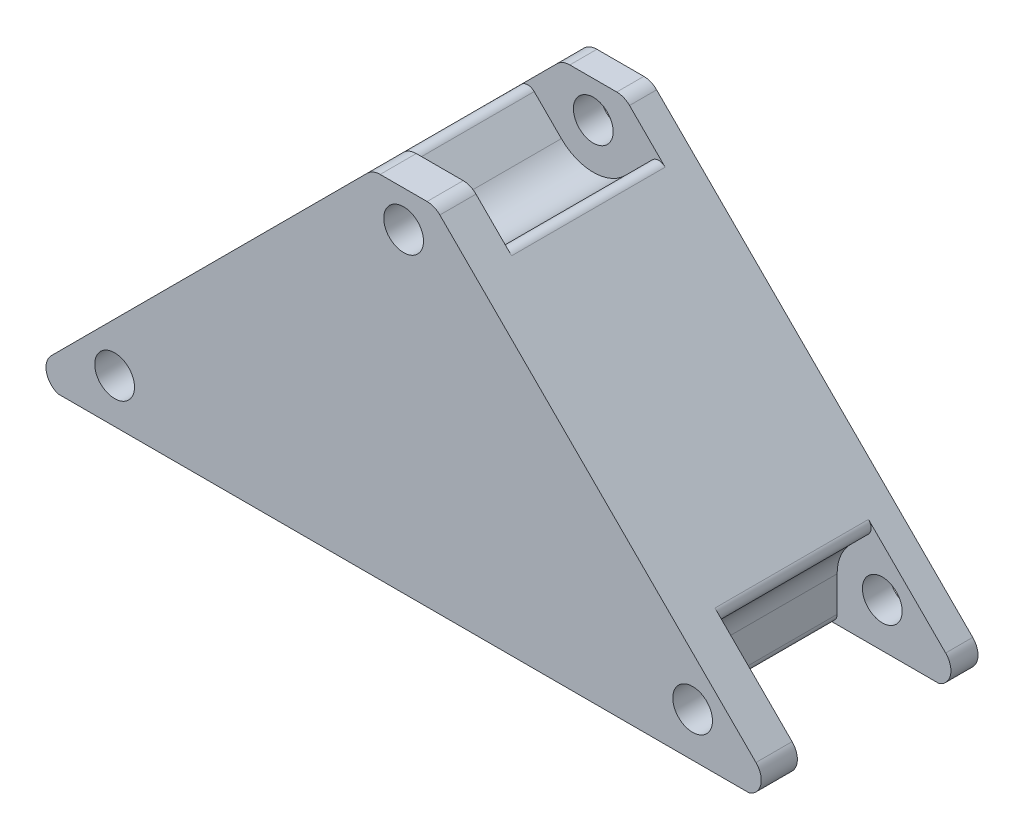
from build123d import *

# Parameters (mm, degrees)
SKETCH_1_R          = 2.2
EXTRUDE_1_DEPTH     = 24
CUT_EXTRUDE_START   = -4
CUT_EXTRUDE_1_DEPTH = 17
FILLET_1_R          = 1


with BuildPart() as part:
    # 草图1 → 凸台-拉伸1 (new body)
    with BuildSketch(Plane.XY):
        with BuildLine():
            ThreePointArc((-71.830585516, -142.550559143), (-72.368769012, -144.398530389), (-71.098720838, -145.844772706))
            Line((-71.098720838, -145.844772706), (5.461936424, -145.844772706))
            ThreePointArc((5.461936424, -145.844772706), (6.731984597, -144.398530389), (6.193801102, -142.550559143))
            Line((6.193801102, -142.550559143), (-28.806198899, -107.550559143))
            ThreePointArc((-28.806198899, -107.550559143), (-29.455045597, -107.11701364), (-30.220412461, -106.964772705))
            Line((-30.220412461, -106.964772705), (-35.416371953, -106.964772705))
            ThreePointArc((-35.416371953, -106.964772705), (-36.181738818, -107.11701364), (-36.830585516, -107.550559143))
            Line((-36.830585516, -107.550559143), (-71.830585516, -142.550559143))
        make_face()
        with Locations((-64.818392207, -140.964772706)):
            Circle(SKETCH_1_R, mode=Mode.SUBTRACT)
        with Locations((-0.818392207, -140.964772706)):
            Circle(SKETCH_1_R, mode=Mode.SUBTRACT)
        with Locations((-32.818392207, -110.964772705)):
            Circle(SKETCH_1_R, mode=Mode.SUBTRACT)
    extrude(amount=EXTRUDE_1_DEPTH)

    # 草图2 → 切除-拉伸1 (cut)
    with BuildSketch(Plane.XY.offset(24).offset(CUT_EXTRUDE_START)):
        with BuildLine():
            Line((-40.067129549, -110.787103176), (-36.353926113, -114.500306611))
            ThreePointArc((-36.353926113, -114.500306611), (-32.818392207, -115.964772705), (-29.282858301, -114.500306611))
            Line((-29.282858301, -114.500306611), (-25.569654866, -110.787103176))
            Line((-25.569654866, -110.787103176), (-32.818392207, -103.538365834))
            Line((-32.818392207, -103.538365834), (-40.067129549, -110.787103176))
        make_face()
        with BuildLine():
            Line((-63.996061737, -134.716035364), (-61.282858301, -137.4292388))
            ThreePointArc((-61.282858301, -137.4292388), (-60.198994545, -139.051355544), (-59.818392207, -140.964772706))
            Line((-59.818392207, -140.964772706), (-59.818392207, -145.844772706))
            Line((-59.818392207, -145.844772706), (-75.124799079, -145.844772706))
            Line((-75.124799079, -145.844772706), (-63.996061737, -134.716035364))
        make_face()
        with BuildLine():
            Line((9.488014664, -145.844772706), (-5.818392207, -145.844772706))
            Line((-5.818392207, -145.844772706), (-5.818392207, -140.964772706))
            ThreePointArc((-5.818392207, -140.964772706), (-5.43778987, -139.051355544), (-4.353926113, -137.4292388))
            Line((-4.353926113, -137.4292388), (-1.640722678, -134.716035364))
            Line((-1.640722678, -134.716035364), (9.488014664, -145.844772706))
        make_face()
    extrude(amount=-CUT_EXTRUDE_1_DEPTH, mode=Mode.SUBTRACT)

    # 圆角1
    fillet_1_edges = [part.edges().sort_by_distance(p)[0] for p in [
        (-59.818392207, -145.844772706, 11.5),
        (-63.996061737, -134.716035364, 11.5),
        (-1.640722678, -134.716035364, 11.5),
        (-5.818392207, -145.844772706, 11.5),
        (-40.067129549, -110.787103176, 11.5),
        (-25.569654866, -110.787103176, 11.5),
    ]]
    fillet(fillet_1_edges, radius=FILLET_1_R)


solid = part.part
